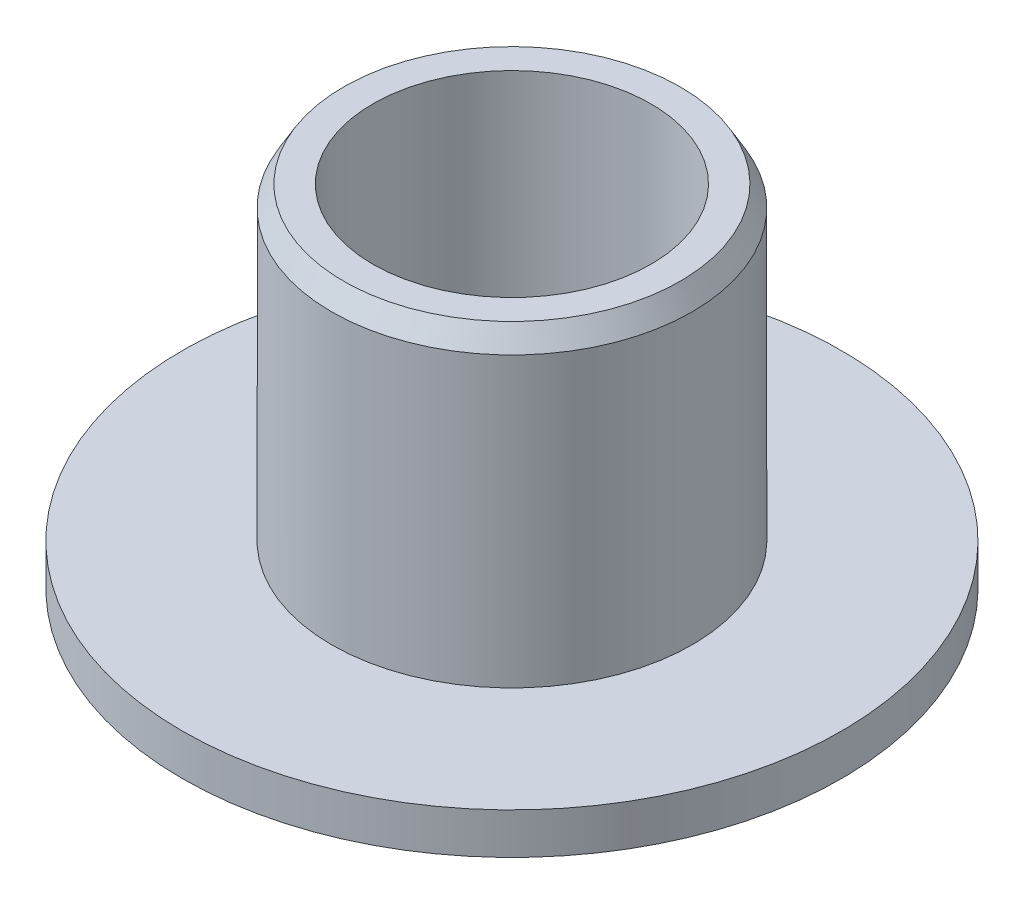
from build123d import *

# Parameters (mm, degrees)
CHAMFER1_SIZE  = 1
CHAMFER1_SIZE2 = 0.577350269


with BuildPart() as part:
    # Sketch1 → Revolve1 (revolve)
    with BuildSketch(Plane.XY, mode=Mode.PRIVATE) as revolve1_sk:
        Polygon((16, 2), (9, 2), (8.75, 2), (8.75, 17), (6.75, 17), (6.75, 2), (0, 2), (0, 0), (16, 0), align=None)
    revolve(revolve1_sk.sketch.rotate(Axis((0, 21.623043933, 0), (0, -1, 0)), 90), axis=Axis((0, 21.623043933, 0), (0, -1, 0)))

    # Chamfer1
    chamfer1_edges = [part.edges().sort_by_distance(p)[0] for p in [
        (0, 17, -8.75),
    ]]
    chamfer1_side = [part.faces().sort_by_distance(p)[0] for p in [
        (0, 9.5, -8.75),
    ]]
    chamfer(chamfer1_edges, length=CHAMFER1_SIZE, length2=CHAMFER1_SIZE2, reference=chamfer1_side[0])


solid = part.part
